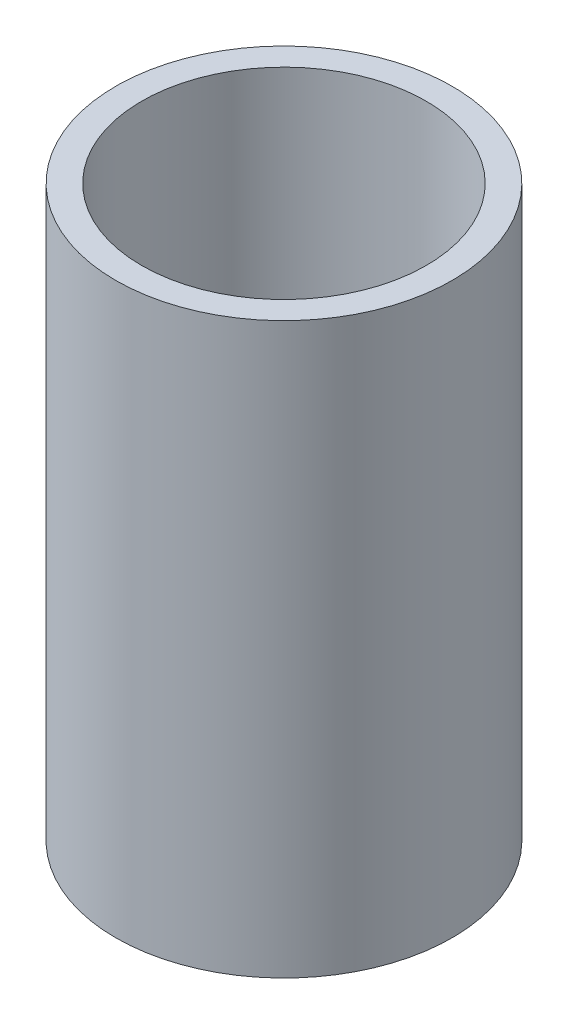
from build123d import *

# Parameters (mm, degrees)
SKETCH1_R           = 3.25
SKETCH1_R_2         = 2.75
BOSS_EXTRUDE1_DEPTH = 11


with BuildPart() as part:
    # Sketch1 → Boss-Extrude1 (new body)
    with BuildSketch(Plane(origin=(0, 0, 0), x_dir=(1, 0, 0), z_dir=(0, 1, 0))):
        with Locations(Location((0, 0, 0), (0, 0, 270))):
            Circle(SKETCH1_R)
        with Locations(Location((0, 0, 0), (0, 0, 270))):
            Circle(SKETCH1_R_2, mode=Mode.SUBTRACT)
    extrude(amount=BOSS_EXTRUDE1_DEPTH)


solid = part.part
